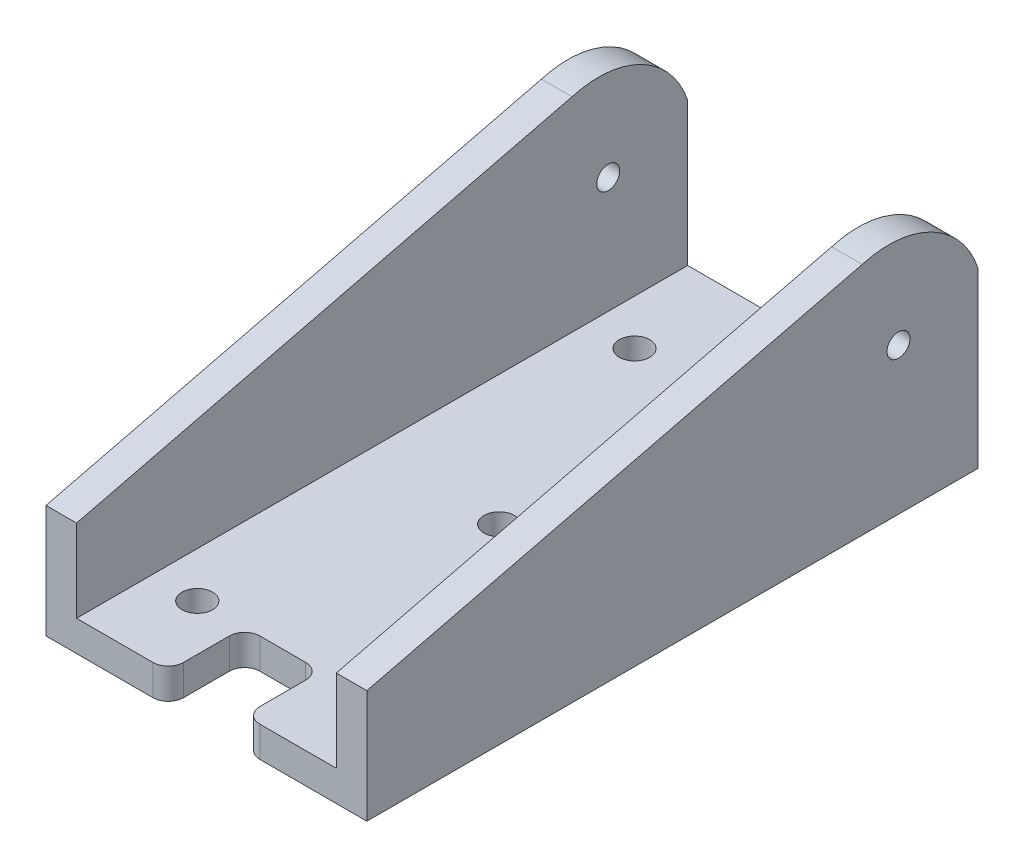
from build123d import *

# Parameters (mm, degrees)
SKETCH1_W                = 10.5
SKETCH1_H                = 20
BOSS_EXTRUDE1_DEPTH      = 10
SHELL2_T                 = -1
SKETCH2_W                = 2.5
SKETCH2_H                = 2.5
CUT_EXTRUDE1_DEPTH       = 1
SKETCH3_W                = 8.5
SKETCH3_H                = 19
CUT_EXTRUDE2_DEPTH       = 1
CUT_EXTRUDE3_DEPTH       = 18.036725037
CUT_EXTRUDE3_DEPTH_BACK  = 18.036725037
SKETCH5_W                = 8.5
SKETCH5_H                = 6.121023644
CUT_EXTRUDE4_DEPTH       = 1
FILLET4_R                = 0.5
CUT_EXTRUDE9_DEPTH       = 17.463595639
CUT_EXTRUDE9_DEPTH_BACK  = 17.463595639
SKETCH10_R               = 0.375
CUT_EXTRUDE10_DEPTH      = 14.182094401
CUT_EXTRUDE10_DEPTH_BACK = 14.182094401
SKETCH11_R               = 0.5


with BuildPart() as part:
    # Sketch1 → Boss-Extrude1 (new body)
    with BuildSketch(Plane(origin=(0, 0, 0), x_dir=(1, 0, 0), z_dir=(0, 1, 0))):
        Rectangle(SKETCH1_W, SKETCH1_H)
    extrude(amount=BOSS_EXTRUDE1_DEPTH)

    # Shell2
    shell2_openings = [part.faces().sort_by_distance(p)[0] for p in [
        (0, 5, 10),
    ]]
    offset(amount=SHELL2_T, openings=shell2_openings, kind=Kind.INTERSECTION)

    # Sketch2 → Cut-Extrude1 (cut)
    with BuildSketch(Plane.XZ):
        with Locations((0, 8.75)):
            Rectangle(SKETCH2_W, SKETCH2_H)
    extrude(amount=-CUT_EXTRUDE1_DEPTH, mode=Mode.SUBTRACT)

    # Sketch3 → Cut-Extrude2 (cut)
    with BuildSketch(Plane.XZ.offset(-9)):
        with Locations((0, 0.5)):
            Rectangle(SKETCH3_W, SKETCH3_H)
    extrude(amount=-CUT_EXTRUDE2_DEPTH, mode=Mode.SUBTRACT)

    # Sketch4 → Cut-Extrude3 (cut, two sides: drawn at the far end of the back side and taken through both)
    with BuildSketch(Plane.ZY.offset(4.25).offset(-CUT_EXTRUDE3_DEPTH_BACK)):
        with BuildLine():
            Line((10, 10), (10, 3.699455157))
            Line((10, 3.699455157), (-6.213436391, 7.674325551))
            ThreePointArc((-6.213436391, 7.674325551), (-8.511231515, 7.441745527), (-10, 5.676094289))
            Line((-10, 5.676094289), (-10, 10))
            Line((-10, 10), (10, 10))
        make_face()
    extrude(amount=CUT_EXTRUDE3_DEPTH + CUT_EXTRUDE3_DEPTH_BACK, mode=Mode.SUBTRACT)

    # Sketch5 → Cut-Extrude4 (cut)
    with BuildSketch(Plane.XY.offset(-9)):
        with Locations((0, 4.060511822)):
            Rectangle(SKETCH5_W, SKETCH5_H)
    extrude(amount=-CUT_EXTRUDE4_DEPTH, mode=Mode.SUBTRACT)

    # Fillet4
    fillet4_edges = [part.edges().sort_by_distance(p)[0] for p in [
        (1.25, 0.5, 10),
        (1.25, 0.5, 7.5),
        (-1.25, 0.5, 7.5),
        (-1.25, 0.5, 10),
    ]]
    fillet(fillet4_edges, radius=FILLET4_R)

    # Sketch10 → Cut-Extrude9 (cut, two sides: drawn at the far end of the back side and taken through both)
    with BuildSketch(Plane.ZY.offset(5.25).offset(-CUT_EXTRUDE9_DEPTH_BACK)):
        with Locations((-7.398050854, 4.796107996)):
            Circle(SKETCH10_R)
    extrude(amount=CUT_EXTRUDE9_DEPTH + CUT_EXTRUDE9_DEPTH_BACK, mode=Mode.SUBTRACT)

    # Sketch11 → Cut-Extrude10 (cut, two sides: drawn at the far end of the back side and taken through both)
    with BuildSketch(Plane(origin=(0, 1, 0), x_dir=(1, 0, 0), z_dir=(0, 1, 0)).offset(-CUT_EXTRUDE10_DEPTH_BACK)):
        with Locations(Location((0, -0.418833411, 0), (0, 0, 270))):
            Circle(SKETCH11_R)
        with Locations(Location((2.767046964, -7.614528741, 0), (0, 0, 270))):
            Circle(SKETCH11_R)
        with Locations(Location((-2.767046964, -7.532135283, 0), (0, 0, 270))):
            Circle(SKETCH11_R)
        with Locations(Location((-2.767046964, 6.776861919, 0), (0, 0, 270))):
            Circle(SKETCH11_R)
        with Locations(Location((2.767046964, 6.776861919, 0), (0, 0, 270))):
            Circle(SKETCH11_R)
    extrude(amount=CUT_EXTRUDE10_DEPTH + CUT_EXTRUDE10_DEPTH_BACK, mode=Mode.SUBTRACT)


solid = part.part
